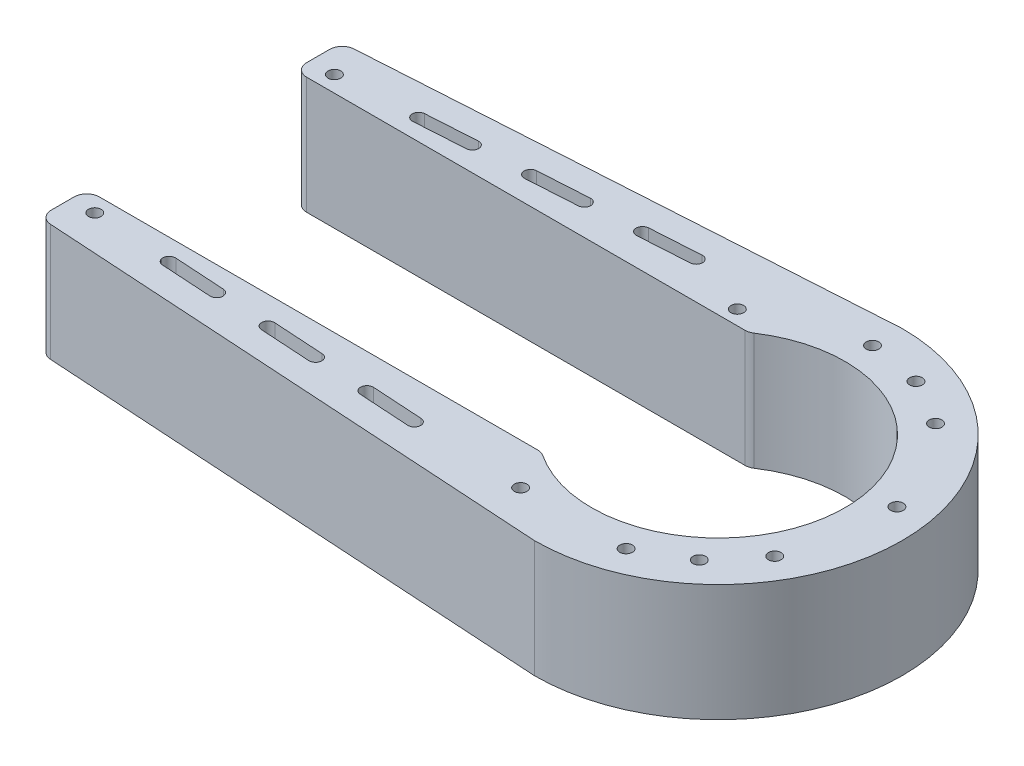
from build123d import *

# Parameters (mm, degrees)
EXTRUDE_1_DEPTH     = 27.7
SKETCH_3_R          = 1.25
SKETCH_3_R_2        = 30
SKETCH_3_R_3        = 1.5
CUT_EXTRUDE_1_DEPTH = 30
CUT_EXTRUDE_2_DEPTH = 3
SKETCH_5_R          = 1.25
SKETCH_5_R_2        = 1.5
CUT_EXTRUDE_3_DEPTH = 30
SKETCH_6_W          = 156.727051789
SKETCH_6_H          = 77.251269398
CUT_EXTRUDE_4_DEPTH = 36
SKETCH_7_W          = 110.29163623
SKETCH_7_H          = 49.067375992
CUT_EXTRUDE_5_DEPTH = 36
FILLET_1_R          = 3
CUT_EXTRUDE_6_DEPTH = 40
FILLET_2_R          = 3


with BuildPart() as part:
    # 草图2 → 凸台-拉伸1 (new body)
    with BuildSketch(Plane(origin=(0, 5, 0), x_dir=(1, 0, 0), z_dir=(0, 1, 0))):
        with BuildLine():
            Line((-250, 28), (0, 43.5))
            ThreePointArc((0, 43.5), (43.5, 0), (0, -43.5))
            Line((0, -43.5), (-250, -28))
            ThreePointArc((-250, -28), (-278, 0), (-250, 28))
        make_face()
    extrude(amount=EXTRUDE_1_DEPTH)

    # 草图3 → 切除-拉伸1 (cut)
    with BuildSketch(Plane(origin=(0, 32.7, 0), x_dir=(1, 0, 0), z_dir=(0, 1, 0))):
        with Locations(Location((-250, 4, 0), (0, 0, 270))):
            Circle(SKETCH_3_R)
        with Locations(Location((-246, 0, 0), (0, 0, 270))):
            Circle(SKETCH_3_R)
        with Locations(Location((-250, -4, 0), (0, 0, 270))):
            Circle(SKETCH_3_R)
        with Locations(Location((-254, 0, 0), (0, 0, 270))):
            Circle(SKETCH_3_R)
        with Locations(Location((0, 0, 0), (0, 0, 270))):
            Circle(SKETCH_3_R_2)
        with Locations(Location((0, 36.5, 0), (0, 0, 270))):
            Circle(SKETCH_3_R_3)
        with Locations(Location((12.483735231, 34.298780659, 0), (0, 0, 270))):
            Circle(SKETCH_3_R_3)
        with Locations(Location((23.461747754, 27.960622174, 0), (0, 0, 270))):
            Circle(SKETCH_3_R_3)
        with Locations(Location((-23.461747754, 27.960622174, 0), (0, 0, 270))):
            Circle(SKETCH_3_R_3)
        with Locations(Location((-35.945482985, 6.338158485, 0), (0, 0, 270))):
            Circle(SKETCH_3_R_3)
        with Locations(Location((-35.945482985, -6.338158485, 0), (0, 0, 270))):
            Circle(SKETCH_3_R_3)
        with Locations(Location((-31.609927238, -18.25, 0), (0, 0, 270))):
            Circle(SKETCH_3_R_3)
        with Locations(Location((-12.483735231, -34.298780659, 0), (0, 0, 270))):
            Circle(SKETCH_3_R_3)
        with Locations(Location((12.483735231, -34.298780659, 0), (0, 0, 270))):
            Circle(SKETCH_3_R_3)
        with Locations(Location((23.461747754, -27.960622174, 0), (0, 0, 270))):
            Circle(SKETCH_3_R_3)
        with Locations(Location((31.609927238, -18.25, 0), (0, 0, 270))):
            Circle(SKETCH_3_R_3)
        with Locations(Location((35.945482985, 6.338158485, 0), (0, 0, 270))):
            Circle(SKETCH_3_R_3)
        with BuildLine():
            ThreePointArc((-265.553651429, 15.553651429), (-265.553651429, 11.316406256), (-261.316406256, 11.316406256))
            ThreePointArc((-261.316406256, 11.316406256), (-250, 16.003815204), (-238.683593744, 11.316406256))
            ThreePointArc((-238.683593744, 11.316406256), (-234.446348571, 11.316406256), (-234.446348571, 15.553651429))
            ThreePointArc((-234.446348571, 15.553651429), (-250, 21.996184796), (-265.553651429, 15.553651429))
        make_face()
        with BuildLine():
            ThreePointArc((-261.316406256, -11.316406256), (-250, -16.003815204), (-238.683593744, -11.316406256))
            ThreePointArc((-238.683593744, -11.316406256), (-234.446348571, -11.316406256), (-234.446348571, -15.553651429))
            ThreePointArc((-234.446348571, -15.553651429), (-250, -21.996184796), (-265.553651429, -15.553651429))
            ThreePointArc((-265.553651429, -15.553651429), (-265.553651429, -11.316406256), (-261.316406256, -11.316406256))
        make_face()
    extrude(amount=-CUT_EXTRUDE_1_DEPTH, mode=Mode.SUBTRACT)

    # 草图4 → 切除-拉伸2 (cut)
    with BuildSketch(Plane(origin=(0, 32.7, 0), x_dir=(1, 0, 0), z_dir=(0, 1, 0))):
        with BuildLine():
            Line((-216.23889617, 1.5), (-205.267472927, 20.503062488))
            ThreePointArc((-205.267472927, 20.503062488), (-199.762485666, 21.978119379), (-198.287428775, 16.473132117))
            Line((-198.287428775, 16.473132117), (-206.932170633, 1.5))
            ThreePointArc((-206.932170633, 1.5), (-207.334094422, 0), (-206.932170633, -1.5))
            Line((-206.932170633, -1.5), (-198.287428775, -16.473132117))
            ThreePointArc((-198.287428775, -16.473132117), (-199.762485666, -21.978119379), (-205.267472927, -20.503062488))
            Line((-205.267472927, -20.503062488), (-216.23889617, -1.5))
            ThreePointArc((-216.23889617, -1.5), (-216.640819958, 0), (-216.23889617, 1.5))
        make_face()
        with BuildLine():
            Line((-54.444025551, 1.5), (-65.7023558, 21))
            ThreePointArc((-65.7023558, 21), (-66.800432012, 22.098076211), (-68.300432012, 22.5))
            Line((-68.300432012, 22.5), (-90.81709251, 22.5))
            ThreePointArc((-90.81709251, 22.5), (-92.31709251, 22.098076211), (-93.415168722, 21))
            Line((-93.415168722, 21), (-104.673498971, 1.5))
            ThreePointArc((-104.673498971, 1.5), (-105.075422759, 0), (-104.673498971, -1.5))
            Line((-104.673498971, -1.5), (-93.415168722, -21))
            ThreePointArc((-93.415168722, -21), (-92.31709251, -22.098076211), (-90.81709251, -22.5))
            Line((-90.81709251, -22.5), (-68.300432012, -22.5))
            ThreePointArc((-68.300432012, -22.5), (-66.800432012, -22.098076211), (-65.7023558, -21))
            Line((-65.7023558, -21), (-54.444025551, -1.5))
            ThreePointArc((-54.444025551, -1.5), (-54.042101763, 0), (-54.444025551, 1.5))
        make_face()
        with BuildLine():
            Line((-188.932170633, -1.5), (-180.287428775, -16.473132117))
            ThreePointArc((-180.287428775, -16.473132117), (-181.762485666, -21.978119379), (-187.267472927, -20.503062488))
            Line((-187.267472927, -20.503062488), (-198.23889617, -1.5))
            ThreePointArc((-198.23889617, -1.5), (-198.640819958, 0), (-198.23889617, 1.5))
            Line((-198.23889617, 1.5), (-187.267472927, 20.503062488))
            ThreePointArc((-187.267472927, 20.503062488), (-181.762485666, 21.978119379), (-180.287428775, 16.473132117))
            Line((-180.287428775, 16.473132117), (-188.932170633, 1.5))
            ThreePointArc((-188.932170633, 1.5), (-189.334094422, 0), (-188.932170633, -1.5))
        make_face()
        with BuildLine():
            Line((-170.932170633, -1.5), (-162.287428775, -16.473132117))
            ThreePointArc((-162.287428775, -16.473132117), (-163.762485666, -21.978119379), (-169.267472927, -20.503062488))
            Line((-169.267472927, -20.503062488), (-180.23889617, -1.5))
            ThreePointArc((-180.23889617, -1.5), (-180.640819958, 0), (-180.23889617, 1.5))
            Line((-180.23889617, 1.5), (-169.267472927, 20.503062488))
            ThreePointArc((-169.267472927, 20.503062488), (-163.762485666, 21.978119379), (-162.287428775, 16.473132117))
            Line((-162.287428775, 16.473132117), (-170.932170633, 1.5))
            ThreePointArc((-170.932170633, 1.5), (-171.334094422, 0), (-170.932170633, -1.5))
        make_face()
        with BuildLine():
            Line((-152.932170633, -1.5), (-144.287428775, -16.473132117))
            ThreePointArc((-144.287428775, -16.473132117), (-145.762485666, -21.978119379), (-151.267472927, -20.503062488))
            Line((-151.267472927, -20.503062488), (-162.23889617, -1.5))
            ThreePointArc((-162.23889617, -1.5), (-162.640819958, 0), (-162.23889617, 1.5))
            Line((-162.23889617, 1.5), (-151.267472927, 20.503062488))
            ThreePointArc((-151.267472927, 20.503062488), (-145.762485666, 21.978119379), (-144.287428775, 16.473132117))
            Line((-144.287428775, 16.473132117), (-152.932170633, 1.5))
            ThreePointArc((-152.932170633, 1.5), (-153.334094422, 0), (-152.932170633, -1.5))
        make_face()
        with BuildLine():
            Line((-134.932170633, -1.5), (-126.287428775, -16.473132117))
            ThreePointArc((-126.287428775, -16.473132117), (-127.762485666, -21.978119379), (-133.267472927, -20.503062488))
            Line((-133.267472927, -20.503062488), (-144.23889617, -1.5))
            ThreePointArc((-144.23889617, -1.5), (-144.640819958, 0), (-144.23889617, 1.5))
            Line((-144.23889617, 1.5), (-133.267472927, 20.503062488))
            ThreePointArc((-133.267472927, 20.503062488), (-127.762485666, 21.978119379), (-126.287428775, 16.473132117))
            Line((-126.287428775, 16.473132117), (-134.932170633, 1.5))
            ThreePointArc((-134.932170633, 1.5), (-135.334094422, 0), (-134.932170633, -1.5))
        make_face()
        with BuildLine():
            Line((-116.932170633, -1.5), (-108.287428775, -16.473132117))
            ThreePointArc((-108.287428775, -16.473132117), (-109.762485666, -21.978119379), (-115.267472927, -20.503062488))
            Line((-115.267472927, -20.503062488), (-126.23889617, -1.5))
            ThreePointArc((-126.23889617, -1.5), (-126.640819958, 0), (-126.23889617, 1.5))
            Line((-126.23889617, 1.5), (-115.267472927, 20.503062488))
            ThreePointArc((-115.267472927, 20.503062488), (-109.762485666, 21.978119379), (-108.287428775, 16.473132117))
            Line((-108.287428775, 16.473132117), (-116.932170633, 1.5))
            ThreePointArc((-116.932170633, 1.5), (-117.334094422, 0), (-116.932170633, -1.5))
        make_face()
    extrude(amount=-CUT_EXTRUDE_2_DEPTH, mode=Mode.SUBTRACT)

    # 草图5 → 切除-拉伸3 (cut)
    with BuildSketch(Plane(origin=(0, 32.7, 0), x_dir=(1, 0, 0), z_dir=(0, 1, 0))):
        with Locations(Location((-44.941689831, 32.96361523, 0), (0, 0, 270))):
            Circle(SKETCH_5_R)
        with Locations(Location((-69.702891128, 31.42842075, 0), (0, 0, 270))):
            Circle(SKETCH_5_R)
        with Locations(Location((-119.225293723, 28.358031789, 0), (0, 0, 270))):
            Circle(SKETCH_5_R_2)
        with Locations(Location((-94.464092426, 29.89322627, 0), (0, 0, 270))):
            Circle(SKETCH_5_R)
        with Locations(Location((-44.941689831, -32.96361523, 0), (0, 0, 270))):
            Circle(SKETCH_5_R)
        with Locations(Location((-69.702891128, -31.42842075, 0), (0, 0, 270))):
            Circle(SKETCH_5_R)
        with Locations(Location((-94.464092426, -29.89322627, 0), (0, 0, 270))):
            Circle(SKETCH_5_R)
        with Locations(Location((-119.225293723, -28.358031789, 0), (0, 0, 270))):
            Circle(SKETCH_5_R_2)
    extrude(amount=-CUT_EXTRUDE_3_DEPTH, mode=Mode.SUBTRACT)

    # 草图6 → 切除-拉伸4 (cut)
    with BuildSketch(Plane(origin=(0, 32.7, 0), x_dir=(1, 0, 0), z_dir=(0, 1, 0))):
        with Locations((-203.311864761, 0.008219016)):
            Rectangle(SKETCH_6_W, SKETCH_6_H)
    extrude(amount=-CUT_EXTRUDE_4_DEPTH, mode=Mode.SUBTRACT)

    # 草图7 → 切除-拉伸5 (cut)
    with BuildSketch(Plane(origin=(0, 32.7, 0), x_dir=(1, 0, 0), z_dir=(0, 1, 0))):
        with Locations((-72.411337318, 0)):
            Rectangle(SKETCH_7_W, SKETCH_7_H)
    extrude(amount=-CUT_EXTRUDE_5_DEPTH, mode=Mode.SUBTRACT)

    # 圆角1
    fillet_1_edges = [part.edges().sort_by_distance(p)[0] for p in [
        (-124.948338866, 18.85, -35.75320299),
    ]]
    fillet(fillet_1_edges, radius=FILLET_1_R)

    # 草图8 → 切除-拉伸6 (cut)
    with BuildSketch(Plane(origin=(0, 32.7, 0), x_dir=(1, 0, 0), z_dir=(0, 1, 0))):
        with BuildLine():
            Line((-100.545415334, 31.019064484), (-88.568413053, 31.761638625))
            ThreePointArc((-88.568413053, 31.761638625), (-86.978466, 30.357335108), (-88.382769518, 28.767388055))
            Line((-88.382769518, 28.767388055), (-100.359771799, 28.024813914))
            ThreePointArc((-100.359771799, 28.024813914), (-101.949718852, 29.429117431), (-100.545415334, 31.019064484))
        make_face()
        with BuildLine():
            Line((-75.407683713, 29.571843375), (-63.430681432, 30.314417516))
            ThreePointArc((-63.430681432, 30.314417516), (-62.026377914, 31.904364569), (-63.616324967, 33.308668087))
            Line((-63.616324967, 33.308668087), (-75.593327248, 32.566093945))
            ThreePointArc((-75.593327248, 32.566093945), (-76.997630766, 30.976146893), (-75.407683713, 29.571843375))
        make_face()
        with BuildLine():
            Line((-50.641239162, 34.113123407), (-38.664236881, 34.855697548))
            ThreePointArc((-38.664236881, 34.855697548), (-37.074289828, 33.451394031), (-38.478593346, 31.861446978))
            Line((-38.478593346, 31.861446978), (-50.455595627, 31.118872836))
            ThreePointArc((-50.455595627, 31.118872836), (-52.04554268, 32.523176354), (-50.641239162, 34.113123407))
        make_face()
        with BuildLine():
            Line((-50.641239162, -34.113123407), (-38.664236881, -34.855697548))
            ThreePointArc((-38.664236881, -34.855697548), (-37.074289828, -33.451394031), (-38.478593346, -31.861446978))
            Line((-38.478593346, -31.861446978), (-50.455595627, -31.118872836))
            ThreePointArc((-50.455595627, -31.118872836), (-52.04554268, -32.523176354), (-50.641239162, -34.113123407))
        make_face()
        with BuildLine():
            Line((-75.593327248, -32.566093945), (-63.616324967, -33.308668087))
            ThreePointArc((-63.616324967, -33.308668087), (-62.026377914, -31.904364569), (-63.430681432, -30.314417516))
            Line((-63.430681432, -30.314417516), (-75.407683713, -29.571843375))
            ThreePointArc((-75.407683713, -29.571843375), (-76.997630766, -30.976146893), (-75.593327248, -32.566093945))
        make_face()
        with BuildLine():
            Line((-100.545415334, -31.019064484), (-88.568413053, -31.761638625))
            ThreePointArc((-88.568413053, -31.761638625), (-86.978466, -30.357335108), (-88.382769518, -28.767388055))
            Line((-88.382769518, -28.767388055), (-100.359771799, -28.024813914))
            ThreePointArc((-100.359771799, -28.024813914), (-101.949718852, -29.429117431), (-100.545415334, -31.019064484))
        make_face()
    extrude(amount=-CUT_EXTRUDE_6_DEPTH, mode=Mode.SUBTRACT)

    # 圆角2
    fillet_2_edges = [part.edges().sort_by_distance(p)[0] for p in [
        (-124.948338866, 18.85, 35.75320299),
        (-124.948338866, 18.85, -24.533687996),
        (-124.948338866, 18.85, 24.533687996),
        (-17.265519203, 18.85, 24.533687996),
        (-17.265519203, 18.85, -24.533687996),
    ]]
    fillet(fillet_2_edges, radius=FILLET_2_R)


solid = part.part
